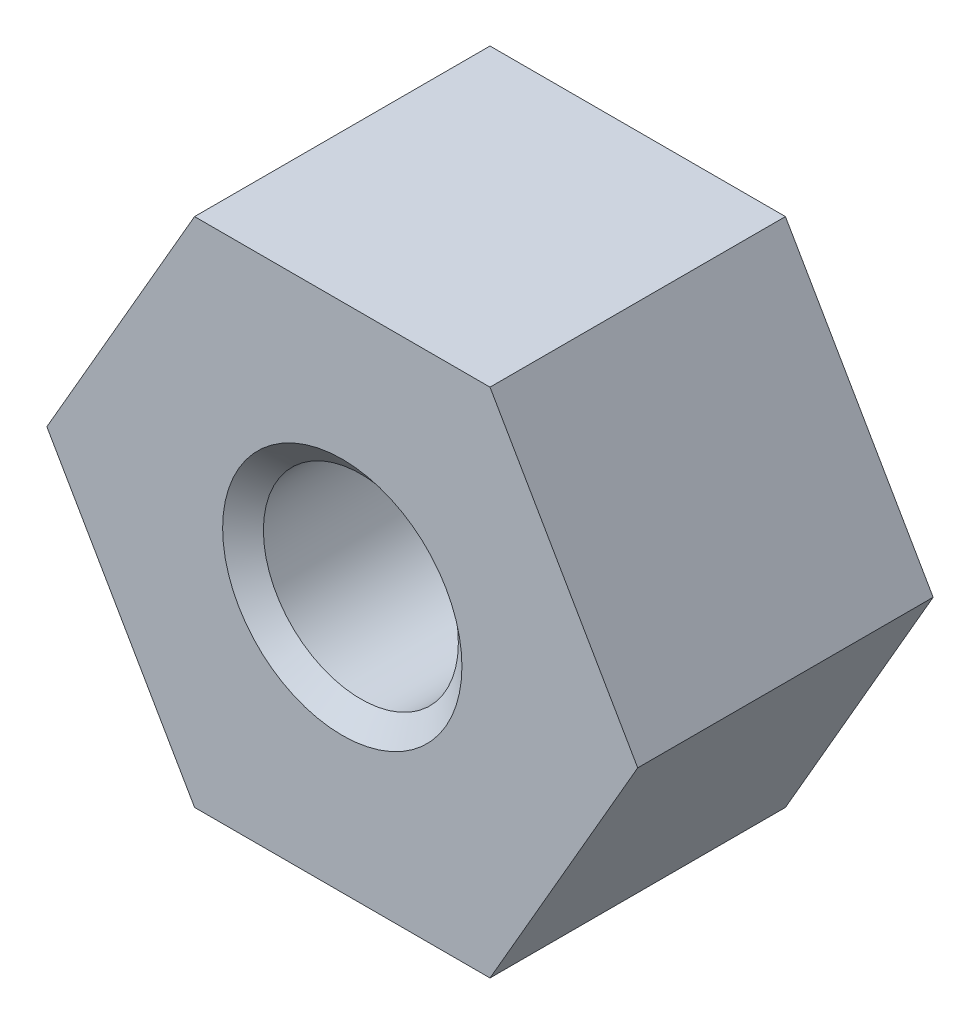
from build123d import *

# Parameters (mm, degrees)
BOSS_EXTRUDE1_DEPTH             = 2.5
M4X0_7_TAPPED_HOLE1_D           = 3.3
M4X0_7_TAPPED_HOLE1_CSINK_D     = 4.05
M4X0_7_TAPPED_HOLE1_CSINK_ANGLE = 100


with BuildPart() as part:
    # Sketch1 → Boss-Extrude1 (new, symmetric)
    with BuildSketch(Plane.XY):
        Polygon((5, 0), (2.5, 4.330127019), (-2.5, 4.330127019), (-5, 0), (-2.5, -4.330127019), (2.5, -4.330127019), align=None)
    extrude(amount=BOSS_EXTRUDE1_DEPTH, both=True)

    # M4x0.7 Tapped Hole1 (through all)
    with Locations(Plane.XY.offset(2.5)):
        with Locations((0, 0)):
            CounterSinkHole(M4X0_7_TAPPED_HOLE1_D / 2, M4X0_7_TAPPED_HOLE1_CSINK_D / 2, counter_sink_angle=M4X0_7_TAPPED_HOLE1_CSINK_ANGLE)


solid = part.part
